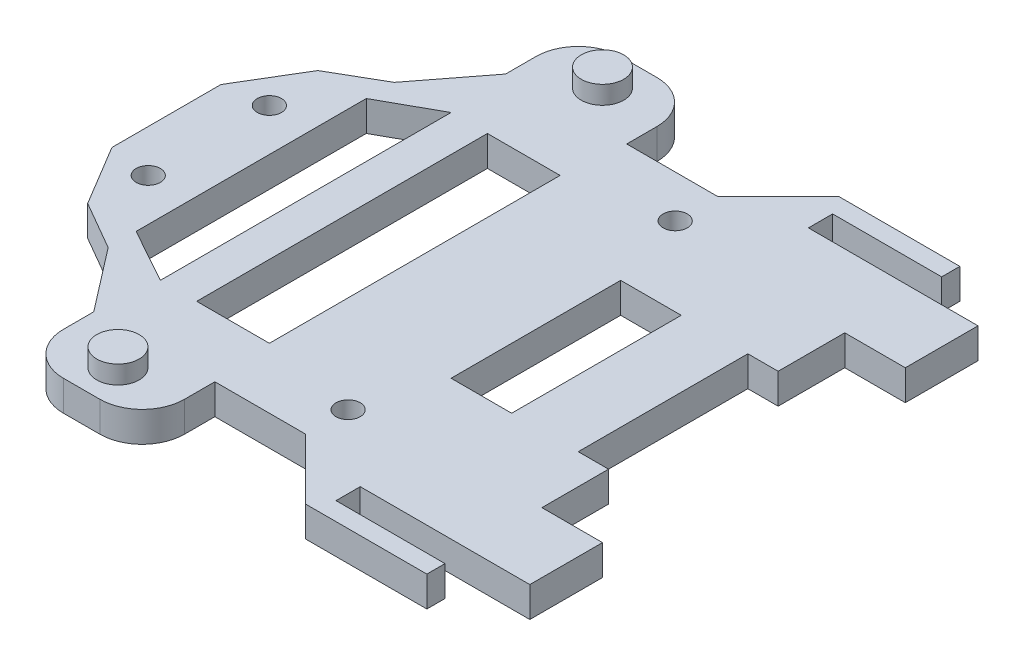
from build123d import *

# Parameters (mm, degrees)
EXTRUDE_1_DEPTH     = 5
SKETCH_2_R          = 2
SKETCH_2_W          = 12
SKETCH_2_H          = 48
SKETCH_2_W_2        = 10
SKETCH_2_H_2        = 28
CUT_EXTRUDE_1_DEPTH = 44
SKETCH_3_R          = 3.5
EXTRUDE_2_DEPTH     = 3
FILLET_1_R          = 7


with BuildPart() as part:
    # 草图1 → 凸台-拉伸1 (new body)
    with BuildSketch(Plane(origin=(0, 0, 0), x_dir=(1, 0, 0), z_dir=(0, 1, 0))):
        Polygon((0, -9), (0, 9), (6, 19), (14, 23.618802154), (22, 34), (22, 46), (42, 46), (42, 34), (57, 34), (67, 44), (87, 44), (87, 41), (69, 41), (69, 37), (97, 37), (97, 25), (87, 25), (87, 14), (82, 14), (82, -14), (87, -14), (87, -25), (97, -25), (97, -37), (69, -37), (69, -41), (87, -41), (87, -44), (67, -44), (57, -34), (42, -34), (42, -46), (22, -46), (22, -34), (14, -23.618802154), (6, -19), align=None)
    extrude(amount=EXTRUDE_1_DEPTH)

    # 草图2 → 切除-拉伸1 (cut)
    with BuildSketch(Plane(origin=(0, 5, 0), x_dir=(1, 0, 0), z_dir=(0, 1, 0))):
        with Locations(Location((7, 10, 0), (0, 0, 270))):
            Circle(SKETCH_2_R)
        with Locations(Location((7, -10, 0), (0, 0, 90))):
            Circle(SKETCH_2_R)
        with Locations(Location((57, 27, 0), (0, 0, 270))):
            Circle(SKETCH_2_R)
        with Locations(Location((57, -27, 0), (0, 0, 90))):
            Circle(SKETCH_2_R)
        Polygon((14, -19), (14, 19), (23, 24), (23, -24), align=None)
        with Locations((35, 0)):
            Rectangle(SKETCH_2_W, SKETCH_2_H)
        with Locations((66, 0)):
            Rectangle(SKETCH_2_W_2, SKETCH_2_H_2)
    extrude(amount=-CUT_EXTRUDE_1_DEPTH, mode=Mode.SUBTRACT)

    # 草图3 → 凸台-拉伸2 (add)
    with BuildSketch(Plane(origin=(0, 5, 0), x_dir=(1, 0, 0), z_dir=(0, 1, 0))):
        with Locations(Location((32, 40, 0), (0, 0, 90))):
            Circle(SKETCH_3_R)
        with Locations(Location((32, -40, 0), (0, 0, 90))):
            Circle(SKETCH_3_R)
    extrude(amount=EXTRUDE_2_DEPTH)

    # 圆角1
    fillet_1_edges = [part.edges().sort_by_distance(p)[0] for p in [
        (22, 2.5, 46),
        (42, 2.5, 46),
        (42, 2.5, -46),
        (22, 2.5, -46),
    ]]
    fillet(fillet_1_edges, radius=FILLET_1_R)


solid = part.part
